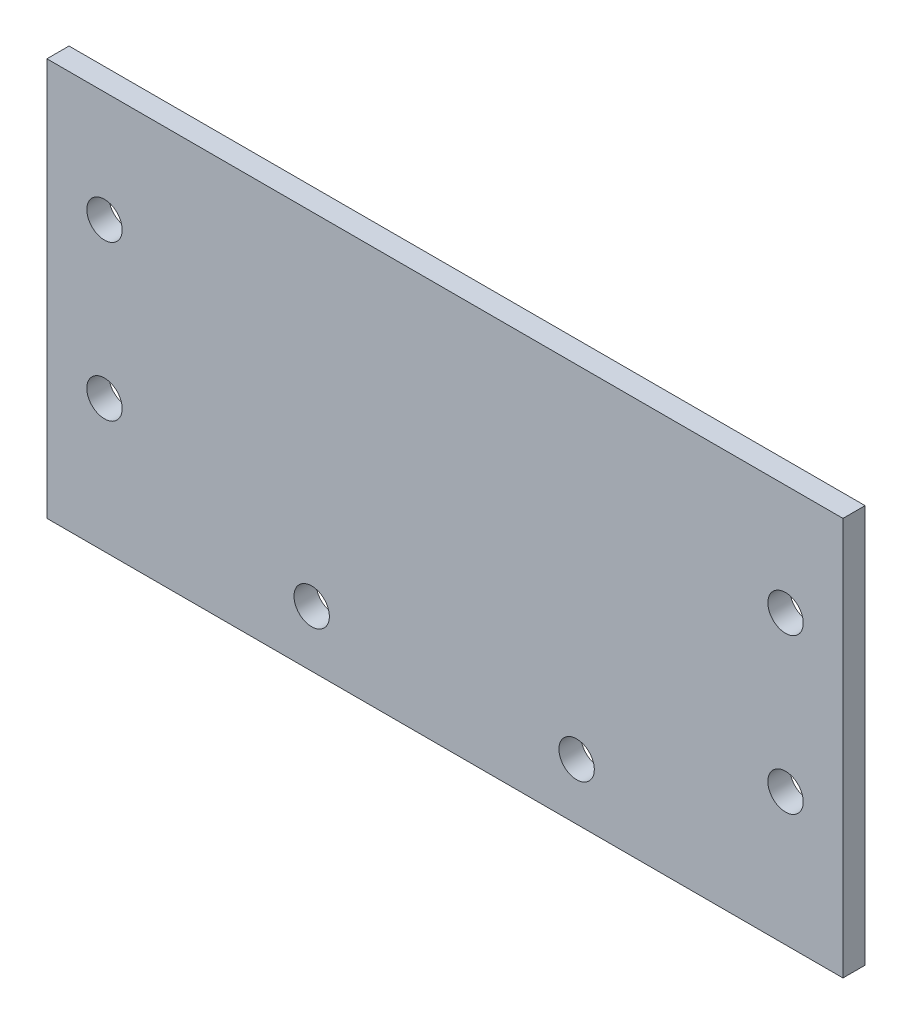
from build123d import *

# Parameters (mm, degrees)
SKETCH1_W             = 180
SKETCH1_H             = 90
BOSS_EXTRUDE1_DEPTH   = 5
F_1_0MM_DOWEL_HOLE1_D = 8


with BuildPart() as part:
    # Sketch1 → Boss-Extrude1 (new body)
    with BuildSketch(Plane.XY):
        with Locations((90, 45)):
            Rectangle(SKETCH1_W, SKETCH1_H)
    extrude(amount=BOSS_EXTRUDE1_DEPTH)

    # Ø1.0mm Dowel Hole1 (through all)
    with Locations(Plane.XY.offset(5)):
        with Locations((119.774053649, 12.716171092), (59.866086211, 12.716171092), (13.018182234, 29.998020195), (13.018182234, 64.997378948), (167.014835527, 64.997378948), (167.014835527, 29.998020195)):
            Hole(F_1_0MM_DOWEL_HOLE1_D / 2)


solid = part.part
